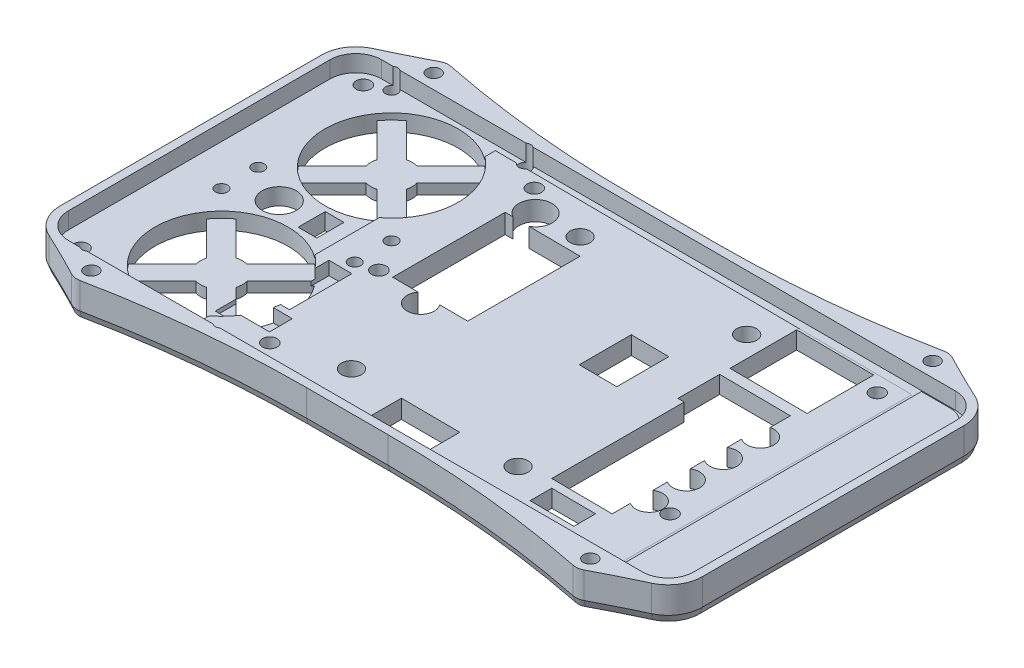
from build123d import *

# Parameters (mm, degrees)
EXTRUDE_1_DEPTH      = 4
EXTRUDE_START        = -2
EXTRUDE_11_DEPTH     = 71.2
SKETCH_2_R           = 2.4
CUT_EXTRUDE_1_DEPTH  = 10
EXTRUDE_9_DEPTH      = 5
EXTRUDE_1_2_DEPTH    = 8
SKETCH_4_W           = 10.5
SKETCH_4_H           = 5.2
SKETCH_4_W_2         = 18.5
SKETCH_4_H_2         = 16
SKETCH_4_R           = 3.25
SKETCH_4_W_3         = 14
SKETCH_4_H_3         = 9
SKETCH_4_W_4         = 9
SKETCH_4_H_4         = 12.5
SKETCH_4_W_5         = 18
SKETCH_4_H_5         = 27
SKETCH_4_R_2         = 4
CUT_EXTRUDE_2_DEPTH  = 171.57842771
SKETCH_2_11_R        = 4.1
SKETCH_2_11_W        = 4.5
SKETCH_2_11_H        = 6.5
CUT_EXTRUDE_3_DEPTH  = 171.57842771
SKETCH_2_13_R        = 1.75
CUT_EXTRUDE_4_DEPTH  = 171.57842771
CUT_EXTRUDE_START    = -1.5
SKETCH_2_14_W        = 5.5
SKETCH_2_14_H        = 15
SKETCH_2_14_W_2      = 13
SKETCH_2_14_H_2      = 5.5
CUT_EXTRUDE_5_DEPTH  = 170.07842771
SKETCH_6_R           = 3.5
SKETCH_6_R_2         = 1.65
EXTRUDE_10_DEPTH     = 8
SKETCH_6_2_R         = 1.65
CUT_EXTRUDE_9_DEPTH  = 173.893030513
FILLET_1_R           = 250
CHAMFER_1_SIZE       = 0.6
CHAMFER_1_SIZE2      = 1.648486452
SKETCH_8_R           = 1.45
CUT_EXTRUDE_10_DEPTH = 173.893030653
CUT_EXTRUDE_11_DEPTH = 10
SKETCH_10_R          = 16
CUT_EXTRUDE_12_DEPTH = 1.5


with BuildPart() as part:
    # 草图1 → Extrude 1 (new body)
    with BuildSketch(Plane(origin=(0, 0, 0), x_dir=(1, 0, 0), z_dir=(0, 1, 0))):
        with BuildLine():
            Line((6, 0.2), (143.8, 0.2))
            ThreePointArc((143.8, 0.2), (148.184062043, -1.615937957), (150, -6))
            Line((150, -6), (150, -68.8))
            ThreePointArc((150, -68.8), (148.184062043, -73.184062043), (143.8, -75))
            Line((143.8, -75), (6, -75))
            ThreePointArc((6, -75), (1.615937957, -73.184062043), (-0.2, -68.8))
            Line((-0.2, -68.8), (-0.2, -6))
            ThreePointArc((-0.2, -6), (1.615937957, -1.615937957), (6, 0.2))
        make_face()
    extrude(amount=EXTRUDE_1_DEPTH)

    # 草图7 → 凸台-拉伸11 (add)
    with BuildSketch(Plane(origin=(0, 0, -0.2), x_dir=(-1, 0, 0), z_dir=(0, 0, -1)).offset(EXTRUDE_START)):
        Polygon((-135.3, 4), (-35.3, 4.75), (-35.3, 4), align=None)
    extrude(amount=-EXTRUDE_11_DEPTH)

    # 草图2 → 切除-拉伸1 (cut)
    with BuildSketch(Plane(origin=(0, 0, 0), x_dir=(-1, 0, 0), z_dir=(0, -1, 0))):
        with Locations(Location((-103.2, -9.35, 0), (0, 0, 90))):
            Circle(SKETCH_2_R)
        with Locations(Location((-63.2, -9.35, 0), (0, 0, 90))):
            Circle(SKETCH_2_R)
        with Locations(Location((-63.2, -64.25, 0), (0, 0, 90))):
            Circle(SKETCH_2_R)
        with Locations(Location((-103.2, -64.25, 0), (0, 0, 90))):
            Circle(SKETCH_2_R)
    extrude(amount=-CUT_EXTRUDE_1_DEPTH, mode=Mode.SUBTRACT)

    # 草图3 → 凸台-拉伸9 (add)
    with BuildSketch(Plane(origin=(0, 0, 0), x_dir=(1, 0, 0), z_dir=(0, 1, 0))):
        with BuildLine():
            Line((136.8, -1), (136.8, -73.8))
            Line((136.8, -73.8), (143.8, -73.8))
            ThreePointArc((143.8, -73.8), (147.335533906, -72.335533906), (148.8, -68.8))
            Line((148.8, -68.8), (148.8, -6))
            ThreePointArc((148.8, -6), (147.335533906, -2.464466094), (143.8, -1))
            Line((143.8, -1), (136.8, -1))
        make_face()
    extrude(amount=EXTRUDE_9_DEPTH)

    # 草图1<2> → Extrude 1 2 (add)
    with BuildSketch(Plane(origin=(0, 0, 0), x_dir=(1, 0, 0), z_dir=(0, 1, 0))):
        with BuildLine():
            Line((6, 2.2), (143.8, 2.2))
            ThreePointArc((143.8, 2.2), (149.598275606, -0.201724394), (152, -6))
            Line((152, -6), (152, -68.8))
            ThreePointArc((152, -68.8), (149.598275606, -74.598275606), (143.8, -77))
            Line((143.8, -77), (6, -77))
            ThreePointArc((6, -77), (0.201724394, -74.598275606), (-2.2, -68.8))
            Line((-2.2, -68.8), (-2.2, -6))
            ThreePointArc((-2.2, -6), (0.201724394, -0.201724394), (6, 2.2))
        make_face()
        with BuildLine():
            Line((6, 0.2), (143.8, 0.2))
            ThreePointArc((143.8, 0.2), (148.184062043, -1.615937957), (150, -6))
            Line((150, -6), (150, -68.8))
            ThreePointArc((150, -68.8), (148.184062043, -73.184062043), (143.8, -75))
            Line((143.8, -75), (6, -75))
            ThreePointArc((6, -75), (1.615937957, -73.184062043), (-0.2, -68.8))
            Line((-0.2, -68.8), (-0.2, -6))
            ThreePointArc((-0.2, -6), (1.615937957, -1.615937957), (6, 0.2))
        make_face(mode=Mode.SUBTRACT)
    extrude(amount=EXTRUDE_1_2_DEPTH)

    # 草图4 → 切除-拉伸2 (cut, through all)
    with BuildSketch(Plane(origin=(0, 0, 0), x_dir=(1, 0, 0), z_dir=(0, 1, 0))):
        with Locations((116.95, -67.25)):
            Rectangle(SKETCH_4_W, SKETCH_4_H)
        with Locations((117.45, -10.35)):
            Rectangle(SKETCH_4_W_2, SKETCH_4_H_2)
        Polygon((109.7, -62.65), (124.2, -62.65), (124.2, -30.85), (125.2, -30.85), (125.2, -20.85), (108.2, -20.85), (108.2, -30.85), (109.7, -30.85), align=None)
        with Locations((126, -28.85)):
            Circle(SKETCH_4_R)
        with Locations((126, -37.75)):
            Circle(SKETCH_4_R)
        with Locations((126, -46.65)):
            Circle(SKETCH_4_R)
        with Locations((126, -55.55)):
            Circle(SKETCH_4_R)
        with Locations((82.2, -68.75)):
            Rectangle(SKETCH_4_W_3, SKETCH_4_H_3)
        with Locations((94, -29.6)):
            Rectangle(SKETCH_4_W_4, SKETCH_4_H_4)
        with Locations((58.2, -26.85)):
            Rectangle(SKETCH_4_W_5, SKETCH_4_H_5)
        with Locations((53, -9.85)):
            Circle(SKETCH_4_R_2)
        with Locations((57.9, -42.35)):
            Circle(SKETCH_4_R)
    extrude(amount=CUT_EXTRUDE_2_DEPTH, mode=Mode.SUBTRACT)

    # 草图2<11> → 切除-拉伸3 (cut, through all)
    with BuildSketch(Plane(origin=(0, 0, 0), x_dir=(-1, 0, 0), z_dir=(0, -1, 0))):
        with Locations(Location((-19, -37.4, 0), (0, 0, 90))):
            Circle(SKETCH_2_11_R)
        with Locations((-29.05, -37.4)):
            Rectangle(SKETCH_2_11_W, SKETCH_2_11_H)
    extrude(amount=-CUT_EXTRUDE_3_DEPTH, mode=Mode.SUBTRACT)

    # 草图2<13> → 切除-拉伸4 (cut, through all)
    with BuildSketch(Plane(origin=(0, 0, 0), x_dir=(-1, 0, 0), z_dir=(0, -1, 0))):
        with Locations(Location((-130.8, -5.6, 0), (0, 0, 90))):
            Circle(SKETCH_2_13_R)
        with Locations(Location((-131.1, -55.65, 0), (0, 0, 90))):
            Circle(SKETCH_2_13_R)
        with Locations(Location((-48.1, -68.75, 0), (0, 0, 90))):
            Circle(SKETCH_2_13_R)
        with Locations(Location((-5.05, -71.05, 0), (0, 0, 90))):
            Circle(SKETCH_2_13_R)
        with Locations(Location((-5.05, -3.25, 0), (0, 0, 90))):
            Circle(SKETCH_2_13_R)
        with Locations(Location((-47.7, -4.85, 0), (0, 0, 90))):
            Circle(SKETCH_2_13_R)
        with Locations(Location((-46.11, -40.57, 0), (0, 0, 90))):
            Circle(SKETCH_2_13_R)
    extrude(amount=-CUT_EXTRUDE_4_DEPTH, mode=Mode.SUBTRACT)

    # 草图2<14> → 切除-拉伸5 (cut, through all)
    with BuildSketch(Plane(origin=(0, 0, 0), x_dir=(-1, 0, 0), z_dir=(0, -1, 0)).offset(CUT_EXTRUDE_START)):
        with Locations((-40.85, -52.05)):
            Rectangle(SKETCH_2_14_W, SKETCH_2_14_H)
        with Locations((-39.3, -63.8)):
            Rectangle(SKETCH_2_14_W_2, SKETCH_2_14_H_2)
    extrude(amount=-CUT_EXTRUDE_5_DEPTH, mode=Mode.SUBTRACT)

    # 草图6 → 凸台-拉伸10 (add)
    # profile 1 of 4: a face of its own
    with BuildSketch(Plane(origin=(0, 0, 0), x_dir=(1, 0, 0), z_dir=(0, 1, 0))):
        with Locations((15, 3.7)):
            Circle(SKETCH_6_R)
        with Locations((15, 3.7)):
            Circle(SKETCH_6_R_2, mode=Mode.SUBTRACT)
    # profile 2 of 4: a face of its own
    with BuildSketch(Plane(origin=(0, 0, 0), x_dir=(1, 0, 0), z_dir=(0, 1, 0))):
        with Locations((15, -78.5)):
            Circle(SKETCH_6_R)
        with Locations((15, -78.5)):
            Circle(SKETCH_6_R_2, mode=Mode.SUBTRACT)
    # profile 3 of 4: a face of its own
    with BuildSketch(Plane(origin=(0, 0, 0), x_dir=(1, 0, 0), z_dir=(0, 1, 0))):
        with Locations((134.8, 3.7)):
            Circle(SKETCH_6_R)
        with Locations((134.8, 3.7)):
            Circle(SKETCH_6_R_2, mode=Mode.SUBTRACT)
    # profile 4 of 4: a face of its own
    with BuildSketch(Plane(origin=(0, 0, 0), x_dir=(1, 0, 0), z_dir=(0, 1, 0))):
        with Locations((134.8, -78.5)):
            Circle(SKETCH_6_R)
        with Locations((134.8, -78.5)):
            Circle(SKETCH_6_R_2, mode=Mode.SUBTRACT)
    extrude(amount=EXTRUDE_10_DEPTH)

    # 草图6<2> → 切除-拉伸9 (cut, through all)
    with BuildSketch(Plane(origin=(0, 0, 0), x_dir=(1, 0, 0), z_dir=(0, 1, 0))):
        with Locations(Location((15, 3.7, 0), (0, 0, 90))):
            Circle(SKETCH_6_2_R)
        with Locations(Location((134.8, 3.7, 0), (0, 0, 90))):
            Circle(SKETCH_6_2_R)
        with Locations(Location((134.8, -78.5, 0), (0, 0, 90))):
            Circle(SKETCH_6_2_R)
        with Locations(Location((15, -78.5, 0), (0, 0, 90))):
            Circle(SKETCH_6_2_R)
    extrude(amount=CUT_EXTRUDE_9_DEPTH, mode=Mode.SUBTRACT)

    # 圆角1
    fillet_1_edges = [part.edges().sort_by_distance(p)[0] for p in [
        (18.16227766, 4, 77),
        (11.83772234, 4, 77),
        (137.96227766, 4, 77),
        (131.63772234, 4, 77),
        (131.63772234, 4, -2.2),
        (137.96227766, 4, -2.2),
        (11.83772234, 4, -2.2),
        (18.16227766, 4, -2.2),
    ]]
    fillet(fillet_1_edges, radius=FILLET_1_R)

    # 倒角1
    chamfer_1_edges = [part.edges().sort_by_distance(p)[0] for p in [
        (14.502874151, 0, 81.964515246),
        (74.9, 0, 77),
        (135.297125849, 0, 81.964515246),
        (150.714252509, 0, 73.20830038),
        (135.297125849, 0, -7.164515246),
        (74.9, 0, -2.2),
        (14.502874151, 0, -7.164515246),
        (-0.914252509, 0, 1.59169962),
        (40.273083878, 0, 78.235796001),
        (7.988030543, 0, 78.850628869),
        (109.526916122, 0, 78.235796001),
        (141.811969457, 0, 78.850628869),
        (141.811969457, 0, -4.050628869),
        (109.526916122, 0, -3.435796001),
        (7.988030543, 0, -4.050628869),
        (40.273083878, 0, -3.435796001),
        (-2.2, 0, 37.4),
        (-0.914252509, 0, 73.20830038),
        (152, 0, 37.4),
        (150.714252509, 0, 1.59169962),
    ]]
    chamfer_1_side = [part.faces().sort_by_distance(p)[0] for p in [
        (71.508527878, 0, 38.056427383),
    ]]
    chamfer(chamfer_1_edges, length=CHAMFER_1_SIZE, length2=CHAMFER_1_SIZE2, reference=chamfer_1_side[0])

    # 草图8 → 切除-拉伸10 (cut, through all)
    with BuildSketch(Plane.XZ):
        with Locations(Location((41.552498021, 0.980721458, 0), (0, 0, 270))):
            Circle(SKETCH_8_R)
        with Locations(Location((41.552498021, 32.980721458, 0), (0, 0, 270))):
            Circle(SKETCH_8_R)
        with Locations(Location((9.552498021, 32.980721458, 0), (0, 0, 270))):
            Circle(SKETCH_8_R)
        with Locations(Location((9.552498021, 0.980721458, 0), (0, 0, 270))):
            Circle(SKETCH_8_R)
        with Locations(Location((9.552498021, 73.819278542, 0), (0, 0, 54.517284302))):
            Circle(SKETCH_8_R)
        with Locations(Location((9.552498021, 41.819278542, 0), (0, 0, 90))):
            Circle(SKETCH_8_R)
        with Locations((41.552498021, 41.819278542)):
            Circle(SKETCH_8_R)
        with Locations(Location((41.552498021, 73.819278542, 0), (0, 0, 325.596341786))):
            Circle(SKETCH_8_R)
    extrude(amount=-CUT_EXTRUDE_10_DEPTH, mode=Mode.SUBTRACT)

    # 草图9 → 切除-拉伸11 (cut)
    with BuildSketch(Plane.XZ):
        with BuildLine():
            ThreePointArc((34.959479388, 29.92323673), (25.552498021, 32.980721458), (16.145516655, 29.92323673))
            Line((16.145516655, 29.92323673), (24.258402796, 21.81035059))
            ThreePointArc((24.258402796, 21.81035059), (25.552498021, 21.980721458), (26.846593247, 21.81035059))
            Line((26.846593247, 21.81035059), (34.959479388, 29.92323673))
        make_face()
        with BuildLine():
            ThreePointArc((41.552498021, 16.980721458), (40.768940515, 21.926414314), (38.495013293, 26.387702825))
            Line((38.495013293, 26.387702825), (30.382127153, 18.274816684))
            ThreePointArc((30.382127153, 18.274816684), (30.509722328, 17.633352419), (30.552498021, 16.980721458))
            ThreePointArc((30.552498021, 16.980721458), (30.509722328, 16.328090497), (30.382127153, 15.686626233))
            Line((30.382127153, 15.686626233), (38.495013293, 7.573740092))
            ThreePointArc((38.495013293, 7.573740092), (40.768940515, 12.035028603), (41.552498021, 16.980721458))
        make_face()
        with BuildLine():
            Line((24.258402796, 12.151092327), (16.145516655, 4.038206186))
            ThreePointArc((16.145516655, 4.038206186), (25.552498021, 0.980721458), (34.959479388, 4.038206186))
            Line((34.959479388, 4.038206186), (26.846593247, 12.151092327))
            ThreePointArc((26.846593247, 12.151092327), (25.552498021, 11.980721458), (24.258402796, 12.151092327))
        make_face()
        with BuildLine():
            Line((20.72286889, 18.274816684), (12.609982749, 26.387702825))
            ThreePointArc((12.609982749, 26.387702825), (9.552498021, 16.980721458), (12.609982749, 7.573740092))
            Line((12.609982749, 7.573740092), (20.72286889, 15.686626233))
            ThreePointArc((20.72286889, 15.686626233), (20.552498021, 16.980721458), (20.72286889, 18.274816684))
        make_face()
        with BuildLine():
            ThreePointArc((12.609982749, 67.226259908), (9.552498021, 57.819278542), (12.609982749, 48.412297175))
            Line((12.609982749, 48.412297175), (20.72286889, 56.525183316))
            ThreePointArc((20.72286889, 56.525183316), (20.552498021, 57.819278542), (20.72286889, 59.113373767))
            Line((20.72286889, 59.113373767), (12.609982749, 67.226259908))
        make_face()
        with BuildLine():
            Line((26.846593247, 62.648907673), (34.959479388, 70.761793814))
            ThreePointArc((34.959479388, 70.761793814), (25.552498021, 73.819278542), (16.145516655, 70.761793814))
            Line((16.145516655, 70.761793814), (24.258402796, 62.648907673))
            ThreePointArc((24.258402796, 62.648907673), (25.552498021, 62.819278542), (26.846593247, 62.648907673))
        make_face()
        with BuildLine():
            Line((30.382127153, 56.525183316), (38.495013293, 48.412297175))
            ThreePointArc((38.495013293, 48.412297175), (40.768940515, 52.873585686), (41.552498021, 57.819278542))
            ThreePointArc((41.552498021, 57.819278542), (40.768940515, 62.764971397), (38.495013293, 67.226259908))
            Line((38.495013293, 67.226259908), (30.382127153, 59.113373767))
            ThreePointArc((30.382127153, 59.113373767), (30.509722328, 58.471909503), (30.552498021, 57.819278542))
            ThreePointArc((30.552498021, 57.819278542), (30.509722328, 57.166647581), (30.382127153, 56.525183316))
        make_face()
        with BuildLine():
            ThreePointArc((16.145516655, 44.87676327), (25.552498021, 41.819278542), (34.959479388, 44.87676327))
            Line((34.959479388, 44.87676327), (26.846593247, 52.98964941))
            ThreePointArc((26.846593247, 52.98964941), (25.552498021, 52.819278542), (24.258402796, 52.98964941))
            Line((24.258402796, 52.98964941), (16.145516655, 44.87676327))
        make_face()
    extrude(amount=-CUT_EXTRUDE_11_DEPTH, mode=Mode.SUBTRACT)

    # 草图10 → 切除-拉伸12 (cut, symmetric)
    with BuildSketch(Plane(origin=(0, 4, 0), x_dir=(1, 0, 0), z_dir=(0, 1, 0))):
        with Locations(Location((25.552498021, -16.980721458, 0), (0, 0, 53.989299345))):
            Circle(SKETCH_10_R)
        with Locations((25.552498021, -57.819278542)):
            Circle(SKETCH_10_R)
    extrude(amount=CUT_EXTRUDE_12_DEPTH, both=True, mode=Mode.SUBTRACT)


solid = part.part
